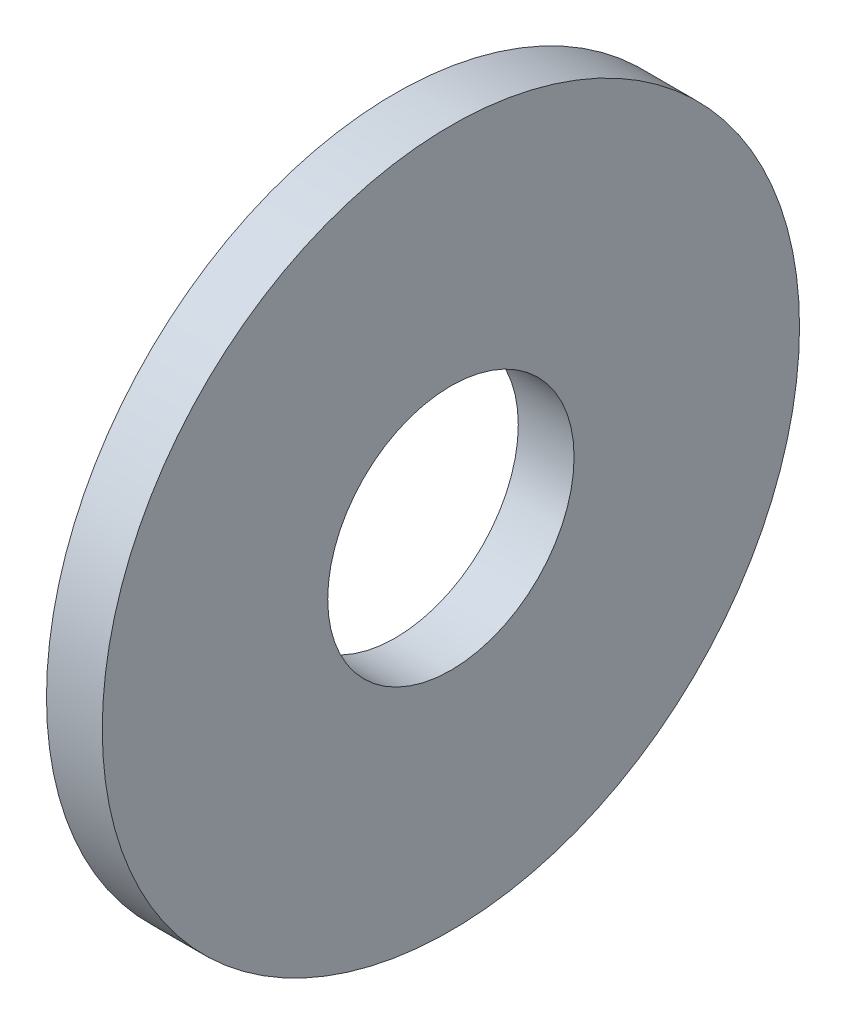
from build123d import *

# Parameters (mm, degrees)
SKETCH1_W = 1.2
SKETCH1_H = 4.85


with BuildPart() as part:
    # Sketch1 → Base-Revolve (revolve)
    with BuildSketch(Plane.XY, mode=Mode.PRIVATE) as base_revolve_sk:
        with Locations((-0.6, 5.075)):
            Rectangle(SKETCH1_W, SKETCH1_H)
    revolve(base_revolve_sk.sketch.rotate(Axis((-34.925, 0, 0), (1, 0, 0)), 90), axis=Axis((-34.925, 0, 0), (1, 0, 0)))


solid = part.part
